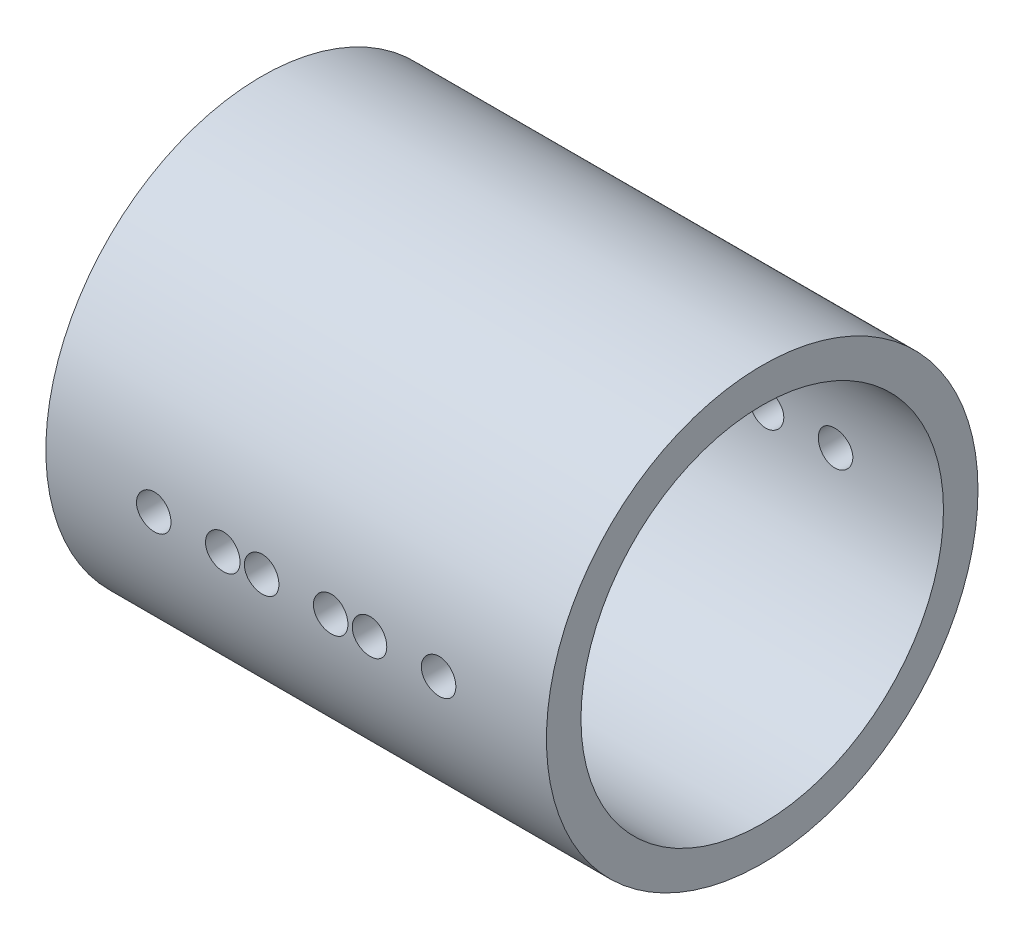
from build123d import *

# Parameters (mm, degrees)
SKETCH_2_R               = 25
SKETCH_2_R_2             = 21
EXTRUDE_2_DEPTH          = 58
CUT_EXTRUDE_2_DEPTH      = 10
CUT_EXTRUDE_2_DEPTH_BACK = 81.554329493
SKETCH_4_R               = 2


with BuildPart() as part:
    # Эскиз2 → Бобышка-Вытянуть2 (new body)
    with BuildSketch(Plane(origin=(0, 0, 0), x_dir=(0, 0, -1), z_dir=(1, 0, 0))):
        Circle(SKETCH_2_R)
        Circle(SKETCH_2_R_2, mode=Mode.SUBTRACT)
    extrude(amount=EXTRUDE_2_DEPTH)

    # Эскиз4 → Вырез-Вытянуть2 (cut, two sides: drawn at the far end of the back side and taken through both)
    with BuildSketch(Plane.XY.offset(25).offset(-CUT_EXTRUDE_2_DEPTH_BACK)):
        with Locations((12.5, 0)):
            Circle(SKETCH_4_R)
        with Locations((45.5, 0)):
            Circle(SKETCH_4_R)
        with Locations((25, 0)):
            Circle(SKETCH_4_R)
        with Locations((37.5, 0)):
            Circle(SKETCH_4_R)
        with Locations((33, 0)):
            Circle(SKETCH_4_R)
        with Locations((20.5, 0)):
            Circle(SKETCH_4_R)
    extrude(amount=CUT_EXTRUDE_2_DEPTH + CUT_EXTRUDE_2_DEPTH_BACK, mode=Mode.SUBTRACT)


solid = part.part
